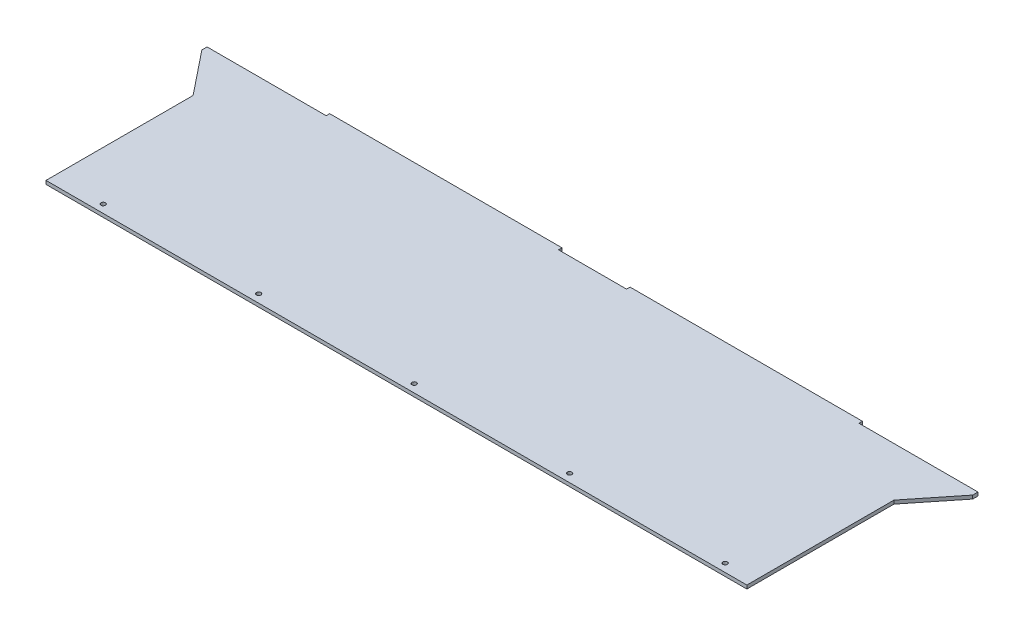
from build123d import *

# Parameters (mm, degrees)
SKETCH1_W           = 635.3556
SKETCH1_H           = 177.8
BOSS_EXTRUDE1_DEPTH = 1.5875
SKETCH2_W           = 210.6549
SKETCH2_H           = 3.175
BOSS_EXTRUDE2_DEPTH = 3.175
BOSS_EXTRUDE3_DEPTH = 3.175
CUT_EXTRUDE1_DEPTH  = 10
LPATTERN1_COUNT     = 5
LPATTERN1_PITCH     = 140.97


with BuildPart() as part:
    # Sketch1 → Boss-Extrude1 (new, symmetric)
    with BuildSketch(Plane(origin=(0, 0, 0), x_dir=(1, 0, 0), z_dir=(0, 1, 0))):
        Rectangle(SKETCH1_W, SKETCH1_H)
    extrude(amount=BOSS_EXTRUDE1_DEPTH, both=True)

    # Sketch2 → Boss-Extrude2 (add)
    with BuildSketch(Plane(origin=(0, 0, -88.9), x_dir=(-1, 0, 0), z_dir=(0, 0, -1))):
        with Locations((-136.15035, 0)):
            Rectangle(SKETCH2_W, SKETCH2_H)
        with Locations((136.15035, 0)):
            Rectangle(SKETCH2_W, SKETCH2_H)
    extrude(amount=BOSS_EXTRUDE2_DEPTH)

    # Sketch3 → Boss-Extrude3 (add)
    with BuildSketch(Plane(origin=(0, 1.5875, 0), x_dir=(1, 0, 0), z_dir=(0, 1, 0))):
        Polygon((-317.6778, 44.45), (-317.6778, 88.9), (-349.4278, 88.9), (-349.4278, 84.1375), align=None)
    boss_extrude3 = extrude(amount=-BOSS_EXTRUDE3_DEPTH)

    # Mirror1: Boss-Extrude3 across plane
    add(boss_extrude3.mirror(Plane(origin=(0, 0, 0), x_dir=(0, 0, 1), z_dir=(1, 0, 0))))

    # Sketch4 → Cut-Extrude1 (cut)
    with BuildSketch(Plane(origin=(0, 1.5875, 0), x_dir=(1, 0, 0), z_dir=(0, 1, 0))):
        with BuildLine():
            ThreePointArc((-275.2528, -81.534), (-274.659691232, -82.965891232), (-273.2278, -83.559))
            Line((-273.2278, -83.559), (-273.2278, -81.534))
            Line((-273.2278, -81.534), (-275.2528, -81.534))
        make_face()
        with BuildLine():
            Line((-273.2278, -81.534), (-273.2278, -83.559))
            ThreePointArc((-273.2278, -83.559), (-271.795908768, -82.965891232), (-271.2028, -81.534))
            ThreePointArc((-271.2028, -81.534), (-273.2278, -79.509), (-275.2528, -81.534))
            Line((-275.2528, -81.534), (-273.2278, -81.534))
        make_face()
    cut_extrude1 = extrude(amount=-CUT_EXTRUDE1_DEPTH, mode=Mode.SUBTRACT)

    # LPattern1: Cut-Extrude1 ×5
    with Locations(*[(i * LPATTERN1_PITCH, 0, 0) for i in range(1, LPATTERN1_COUNT)]):
        add(cut_extrude1, mode=Mode.SUBTRACT)


solid = part.part
